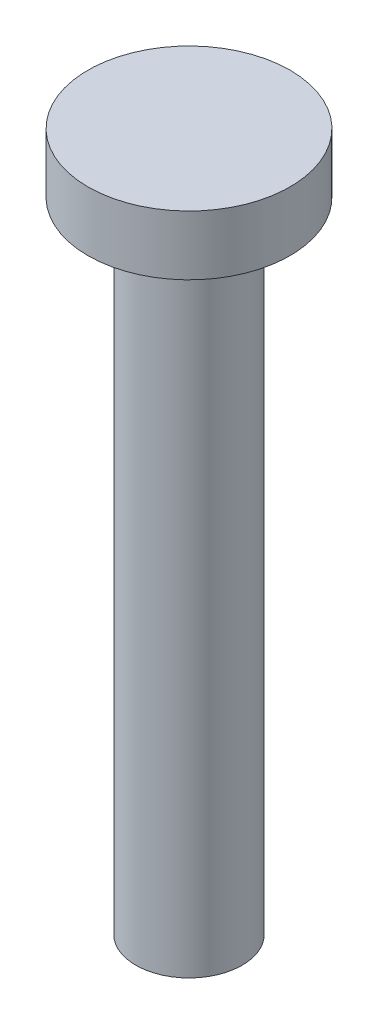
from build123d import *


with BuildPart() as part:
    # Sketch1 → Revolve1 (revolve)
    with BuildSketch(Plane.XY, mode=Mode.PRIVATE) as revolve1_sk:
        Polygon((0, -30), (2.5, -30), (2.5, 0), (4.75, 0), (4.75, 2.8), (0, 2.8), align=None)
    revolve(revolve1_sk.sketch.rotate(Axis((0, -10, 0), (0, 1, 0)), 90), axis=Axis((0, -10, 0), (0, 1, 0)))


solid = part.part
